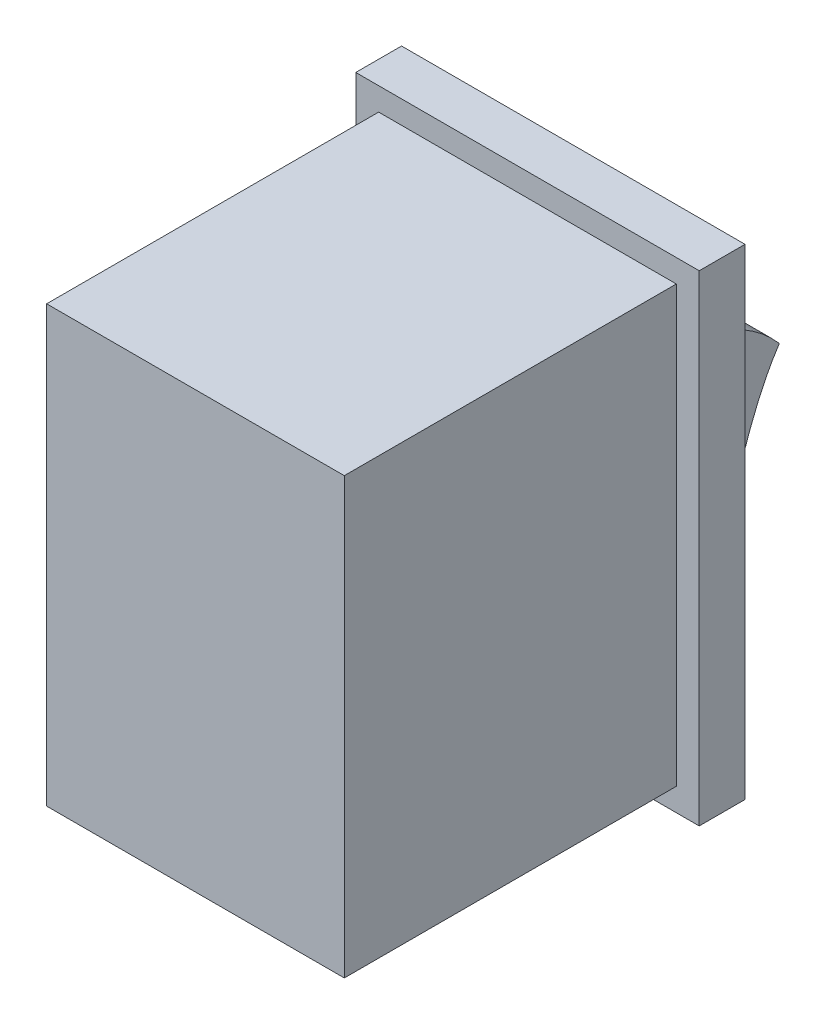
from build123d import *

# Parameters (mm, degrees)
SKETCH1_W                = 13
SKETCH1_H                = 19
BOSS_EXTRUDE1_DEPTH      = 14.5
SKETCH2_W                = 15
SKETCH2_H                = 21
BOSS_EXTRUDE2_DEPTH      = 2
BOSS_EXTRUDE3_DEPTH      = 5.5
BOSS_EXTRUDE3_DEPTH_BACK = 5.5


with BuildPart() as part:
    # Sketch1 → Boss-Extrude1 (new body)
    with BuildSketch(Plane.XY):
        Rectangle(SKETCH1_W, SKETCH1_H)
    extrude(amount=BOSS_EXTRUDE1_DEPTH)

    # Sketch2 → Boss-Extrude2 (add)
    with BuildSketch(Plane.XY):
        Rectangle(SKETCH2_W, SKETCH2_H)
    extrude(amount=-BOSS_EXTRUDE2_DEPTH)

    # Sketch3 → Boss-Extrude3 (add, two sides: drawn at the far end of the back side and taken through both)
    with BuildSketch(Plane(origin=(0, 0, 0), x_dir=(0, 0, -1), z_dir=(1, 0, 0)).offset(-BOSS_EXTRUDE3_DEPTH_BACK)):
        with BuildLine():
            Line((2, -7.5), (2, 6))
            add(Edge.make_bspline(
                [(5.5, 4), (4.114672483, 5.598162681), (2, 6)],
                knots=[0, 0, 0, 1, 1, 1], degree=2))
            add(Edge.make_bspline(
                [(2, -7.5), (3.536685503, 1.127808031), (5.5, 4)],
                knots=[0, 0, 0, 1, 1, 1], degree=2))
        make_face()
    extrude(amount=BOSS_EXTRUDE3_DEPTH + BOSS_EXTRUDE3_DEPTH_BACK)


solid = part.part
